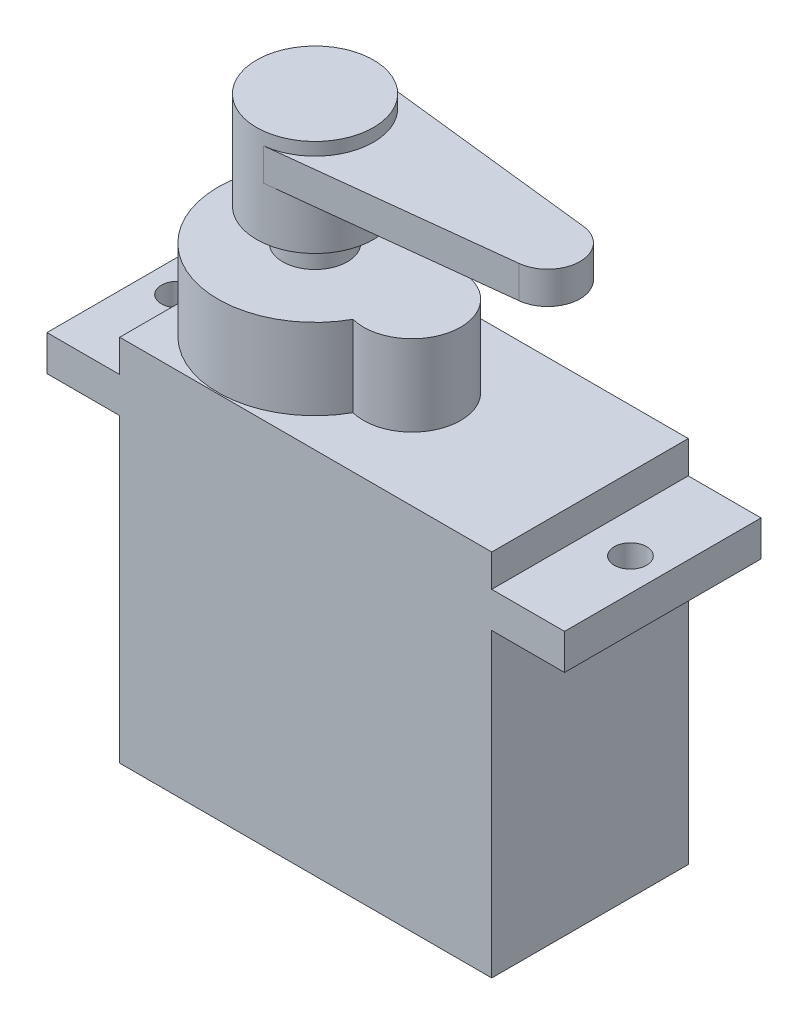
from build123d import *

# Parameters (mm, degrees)
BOSS_EXTRUDE1_DEPTH = 12.15
SKETCH4_R           = 1
CUT_EXTRUDE1_DEPTH  = 12.15
SKETCH5_R           = 6
SKETCH5_R_2         = 3
BOSS_EXTRUDE2_DEPTH = 5
SKETCH6_R           = 2
BOSS_EXTRUDE3_DEPTH = 2
SKETCH7_R           = 3.615
BOSS_EXTRUDE4_DEPTH = 6
BOSS_EXTRUDE5_START = -2.79
BOSS_EXTRUDE5_DEPTH = 2


with BuildPart() as part:
    # Sketch3 → Boss-Extrude1 (new body)
    with BuildSketch(Plane.XY):
        Polygon((8.87359736, -19.274521452), (-14.12640264, -19.274521452), (-14.12640264, -0.664521452), (-18.62640264, -0.664521452), (-18.62640264, 1.535478548), (-14.12640264, 1.535478548), (-14.12640264, 3.535478548), (8.87359736, 3.535478548), (8.87359736, 1.535478548), (13.37359736, 1.535478548), (13.37359736, -0.664521452), (8.87359736, -0.664521452), align=None)
    extrude(amount=BOSS_EXTRUDE1_DEPTH)

    # Sketch4 → Cut-Extrude1 (cut)
    with BuildSketch(Plane(origin=(0, 1.535478548, 0), x_dir=(1, 0, 0), z_dir=(0, 1, 0))):
        with Locations(Location((-16.62640264, -6.075, 0), (0, 0, 270))):
            Circle(SKETCH4_R)
        with Locations(Location((11.37359736, -6.075, 0), (0, 0, 270))):
            Circle(SKETCH4_R)
    extrude(amount=-CUT_EXTRUDE1_DEPTH, mode=Mode.SUBTRACT)

    # Sketch5 → Boss-Extrude2 (add)
    with BuildSketch(Plane(origin=(0, 3.535478548, 0), x_dir=(1, 0, 0), z_dir=(0, 1, 0))):
        with Locations((-8.12640264, -6.075)):
            Circle(SKETCH5_R)
        with Locations((-2.12640264, -6.075)):
            Circle(SKETCH5_R_2)
    extrude(amount=BOSS_EXTRUDE2_DEPTH)

    # Sketch6 → Boss-Extrude3 (add)
    with BuildSketch(Plane(origin=(0, 8.535478548, 0), x_dir=(1, 0, 0), z_dir=(0, 1, 0))):
        with Locations(Location((-8.12640264, -6.075, 0), (0, 0, 270))):
            Circle(SKETCH6_R)
    extrude(amount=BOSS_EXTRUDE3_DEPTH)

    # Sketch7 → Boss-Extrude4 (add)
    with BuildSketch(Plane(origin=(0, 10.535478548, 0), x_dir=(1, 0, 0), z_dir=(0, 1, 0))):
        with Locations(Location((-8.12640264, -6.075, 0), (0, 0, 270))):
            Circle(SKETCH7_R)
    extrude(amount=BOSS_EXTRUDE4_DEPTH)

    # Sketch8 → Boss-Extrude5 (add)
    with BuildSketch(Plane(origin=(0, 16.535478548, 0), x_dir=(1, 0, 0), z_dir=(0, 1, 0)).offset(BOSS_EXTRUDE5_START)):
        with BuildLine():
            ThreePointArc((-7.720547583, -2.482854865), (-5.430536264, -3.666571159), (-4.51140264, -6.075))
            Line((-4.51140264, -6.075), (4.25859736, -6.075))
            ThreePointArc((4.25859736, -6.075), (4.92613327, -4.583510995), (6.483136811, -4.087644462))
            Line((6.483136811, -4.087644462), (-7.720547583, -2.482854865))
        make_face()
        with BuildLine():
            Line((4.25859736, -6.075), (-4.51140264, -6.075))
            ThreePointArc((-4.51140264, -6.075), (-5.430536264, -8.483428841), (-7.720547583, -9.667145135))
            Line((-7.720547583, -9.667145135), (6.483136811, -8.062355538))
            ThreePointArc((6.483136811, -8.062355538), (4.92613327, -7.566489005), (4.25859736, -6.075))
        make_face()
        with BuildLine():
            ThreePointArc((6.483136811, -4.087644462), (4.92613327, -4.583510995), (4.25859736, -6.075))
            Line((4.25859736, -6.075), (8.25859736, -6.075))
            ThreePointArc((8.25859736, -6.075), (7.750086364, -4.742535911), (6.483136811, -4.087644462))
        make_face()
        with BuildLine():
            Line((8.25859736, -6.075), (4.25859736, -6.075))
            ThreePointArc((4.25859736, -6.075), (4.92613327, -7.566489005), (6.483136811, -8.062355538))
            ThreePointArc((6.483136811, -8.062355538), (7.750086364, -7.407464089), (8.25859736, -6.075))
        make_face()
    extrude(amount=BOSS_EXTRUDE5_DEPTH)


solid = part.part
